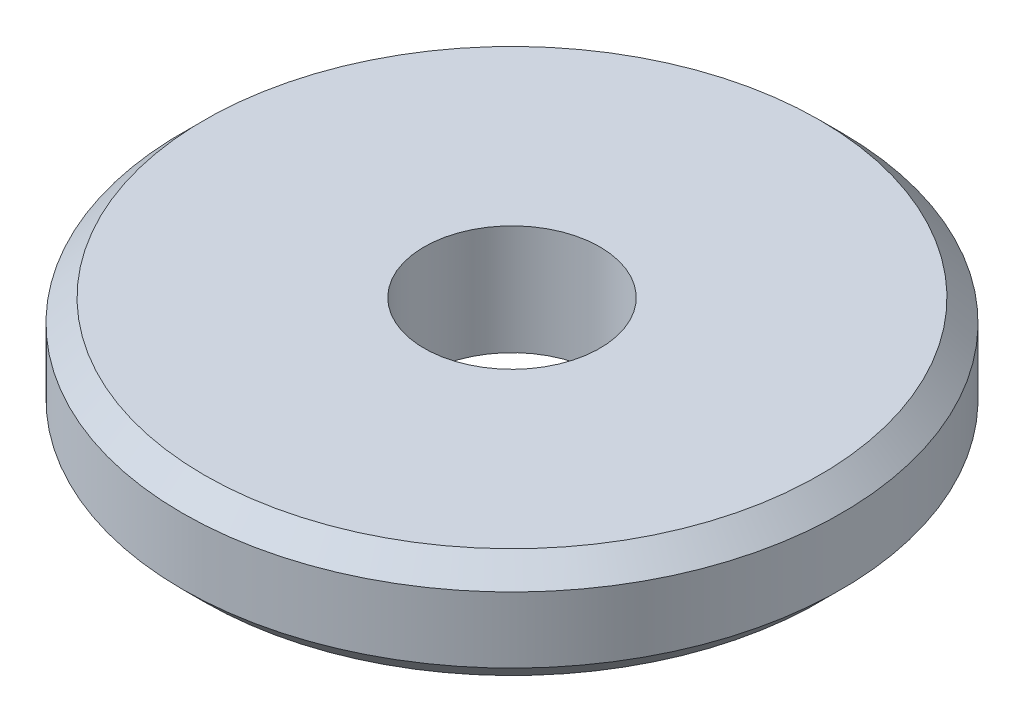
from build123d import *

# Parameters (mm, degrees)
SKETCH_1_R          = 15
EXTRUDE_1_DEPTH     = 5
CHAMFER_1_SIZE      = 1
SKETCH_2_R          = 4
CUT_EXTRUDE_1_DEPTH = 22.794494718


with BuildPart() as part:
    # 草图1 → 凸台-拉伸1 (new body)
    with BuildSketch(Plane(origin=(0, 0, 0), x_dir=(1, 0, 0), z_dir=(0, 1, 0))):
        with Locations(Location((0, 0, 0), (0, 0, 270))):
            Circle(SKETCH_1_R)
    extrude(amount=EXTRUDE_1_DEPTH)

    # 倒角1
    chamfer_1_edges = [part.edges().sort_by_distance(p)[0] for p in [
        (0, 0, -15),
        (0, 5, -15),
    ]]
    chamfer(chamfer_1_edges, length=CHAMFER_1_SIZE)

    # 草图2 → 切除-拉伸1 (cut, through all)
    with BuildSketch(Plane.XZ):
        with Locations(Location((0, 0, 0), (0, 0, 270))):
            Circle(SKETCH_2_R)
    extrude(amount=-CUT_EXTRUDE_1_DEPTH, mode=Mode.SUBTRACT)


solid = part.part
